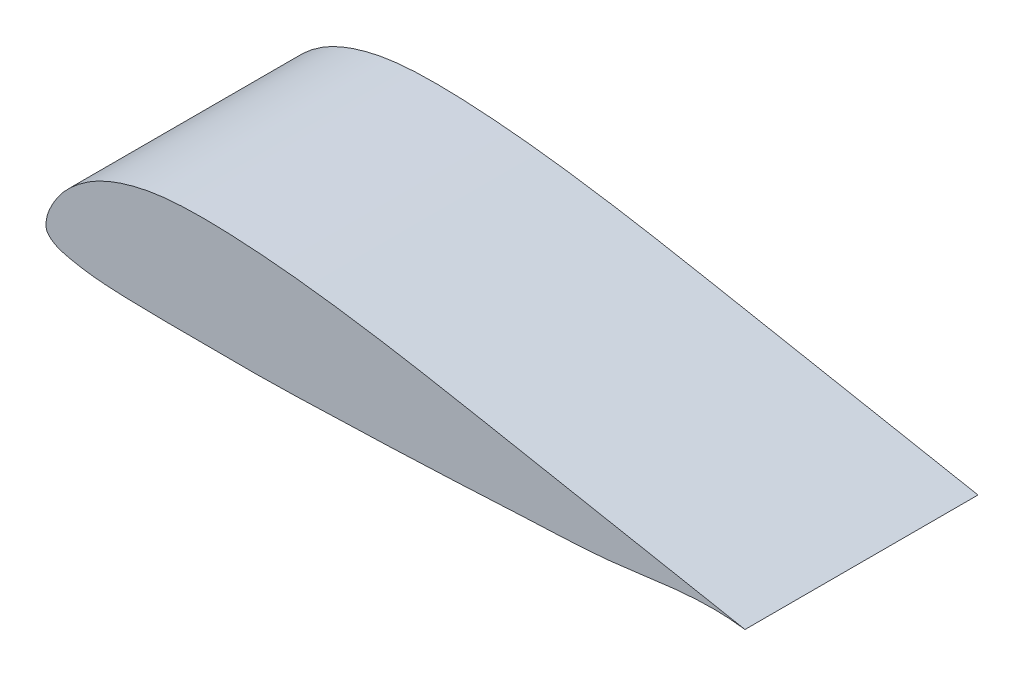
from build123d import *

# Parameters (mm, degrees)
BOSS_EXTRUDE1_DEPTH = 100


with BuildPart() as part:
    # Sketch1 → Boss-Extrude1 (new body)
    with BuildSketch(Plane.XY):
        with BuildLine():
            add(Edge.make_bspline(
                [(0, 0), (-0.061569315, 3.635877789), (2.02311798, 8.571646025), (5.716871998, 14.35167324), (9.684636682, 18.907146154), (14.68165982, 23.222431975), (21.678321773, 27.792902268), (31.657960187, 32.151535747), (44.796111212, 35.494591959), (59.973891815, 36.767696495), (75.011049543, 36.656424828), (95.045136495, 35.57275994), (120.091360879, 32.922814303), (150.074444959, 28.343660979), (180.025171785, 22.833458766), (209.998051758, 17.090164757), (250.001298828, 9.506556828), (279.999350586, 3.796721586), (300, 0)],
                knots=[0, 0, 0, 0, 0.032626759, 0.049882871, 0.06427589, 0.089250813, 0.111667998, 0.142584384, 0.191135501, 0.238340392, 0.285329255, 0.332381604, 0.426846937, 0.521876031, 0.61736406, 0.713023045, 0.80868203, 1, 1, 1, 1], degree=3))
            add(Edge.make_bspline(
                [(0, 0), (0.109965837, -2.088326439), (2.318880242, -4.147402453), (5.885341737, -5.936283724), (9.973517993, -6.945906567), (14.965989304, -7.953610628), (21.977440019, -8.883108377), (31.988390682, -9.547798379), (44.99886863, -9.769274376), (59.999400804, -9.968885143), (74.999888789, -9.935153647), (95.003993643, -10.088973243), (120.003712789, -9.223187036), (150.005412936, -8.28432429), (180.007444474, -6.958276921), (209.992700767, -5.281169279), (250.117414697, -3.992342078), (279.730326225, 2.890679862), (300, 0)],
                knots=[0, 0, 0, 0, 0.017855425, 0.028908382, 0.03917467, 0.059338367, 0.079289859, 0.109027697, 0.158475598, 0.207909101, 0.257339529, 0.306769902, 0.405660631, 0.504578414, 0.603534722, 0.702518879, 0.801545681, 1, 1, 1, 1], degree=3))
        make_face()
    extrude(amount=BOSS_EXTRUDE1_DEPTH)


solid = part.part
